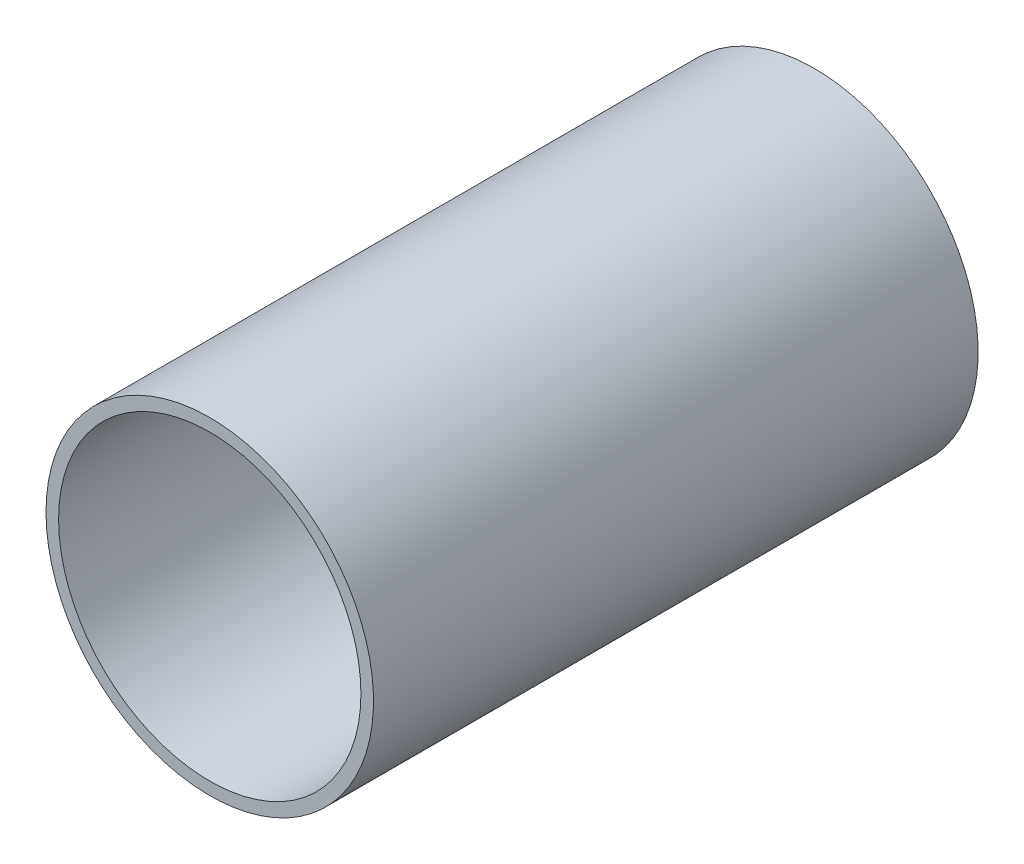
from build123d import *

# Parameters (mm, degrees)
SKETCH1_R           = 82.55
SKETCH1_R_2         = 76.2
BOSS_EXTRUDE1_DEPTH = 304.8


with BuildPart() as part:
    # Sketch1 → Boss-Extrude1 (new body)
    with BuildSketch(Plane.XY):
        with Locations(Location((0, 0, 0), (0, 0, 180))):
            Circle(SKETCH1_R)
        with Locations(Location((0, 0, 0), (0, 0, 180))):
            Circle(SKETCH1_R_2, mode=Mode.SUBTRACT)
    extrude(amount=BOSS_EXTRUDE1_DEPTH)


solid = part.part
